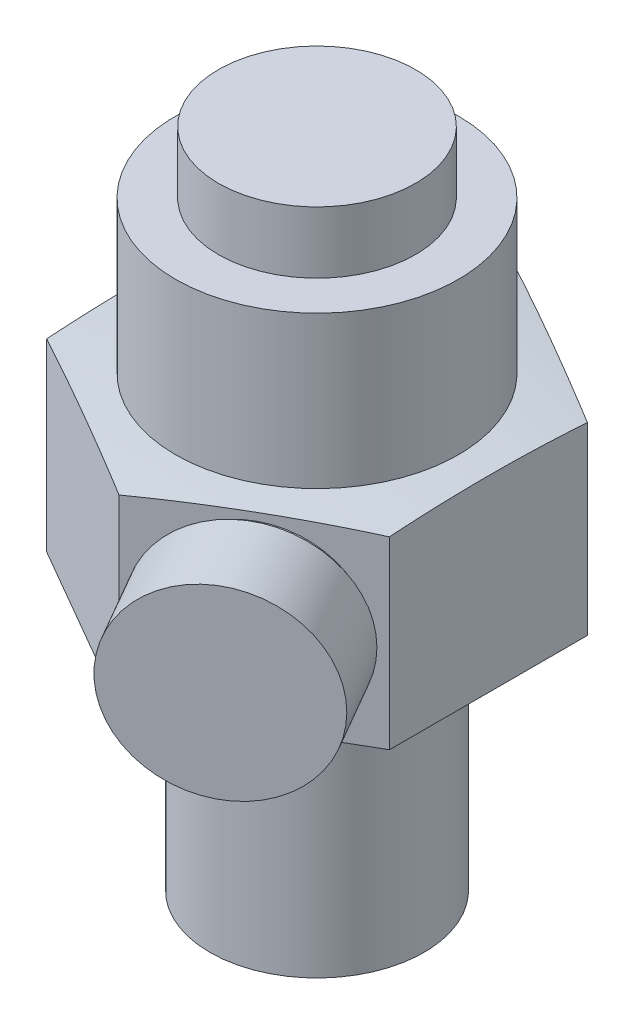
from build123d import *

# Parameters (mm, degrees)
SKETCH2_R                = 31.284897101
CUT_EXTRUDE2_DEPTH       = 58.150000089
SKETCH3_R                = 3.175
BOSS_EXTRUDE1_DEPTH      = 6.35
SKETCH4_R                = 6.35
BOSS_EXTRUDE3_DEPTH      = 6.35
BOSS_EXTRUDE4_DEPTH      = 0.508
BOSS_EXTRUDE4_DEPTH_BACK = 5.588
SKETCH5_R                = 6.858
SKETCH5_R_2              = 6.604
SKETCH5_3_R              = 6.604
BOSS_EXTRUDE5_DEPTH      = 0.508
SKETCH6_R                = 7.3025
BOSS_EXTRUDE6_DEPTH      = 4.572


with BuildPart() as part:
    # Sketch1 → Revolve1 (revolve)
    with BuildSketch(Plane(origin=(0, 0, 0), x_dir=(0, 0, -1), z_dir=(1, 0, 0))):
        with BuildLine():
            Line((10.4775, 33.195692203), (10.4775, 44.45))
            Line((10.4775, 44.45), (0, 44.45))
            Line((0, 44.45), (0, 0))
            Line((0, 0), (7.9375, 0))
            Line((7.9375, 0), (7.9375, 19.05))
            Line((7.9375, 19.05), (25.4, 19.05))
            Line((25.4, 19.05), (25.4, 30.511567858))
            ThreePointArc((25.4, 30.511567858), (17.996597132, 32.175233549), (10.4775, 33.195692203))
        make_face()
    revolve(axis=Axis((0, 0, 0), (0, 1, 0)))

    # Sketch2 → Cut-Extrude2 (cut, through all)
    with BuildSketch(Plane(origin=(0, 0, 0), x_dir=(1, 0, 0), z_dir=(0, 1, 0))):
        Circle(SKETCH2_R)
        Polygon((-12.7, 7.332348419), (0, 14.664696837), (12.7, 7.332348419), (12.7, -7.332348419), (0, -14.664696837), (-12.7, -7.332348419), align=None, mode=Mode.SUBTRACT)
    extrude(amount=CUT_EXTRUDE2_DEPTH, mode=Mode.SUBTRACT)

    # Sketch3 → Boss-Extrude1 (add)
    with BuildSketch(Plane(origin=(-6.35, 0, -10.998522628), x_dir=(-0.8660254037844386, 0, 0.5000000000000002), z_dir=(-0.5000000000000001, 0, -0.8660254037844385))):
        with Locations((0, 26.307433584)):
            Circle(SKETCH3_R)
    extrude(amount=BOSS_EXTRUDE1_DEPTH)

    # Sketch4 → Boss-Extrude3 (add)
    with BuildSketch(Plane(origin=(6.35, 0, 10.998522628), x_dir=(0.8660254037844406, 0, -0.49999999999999684), z_dir=(0.49999999999999684, 0, 0.8660254037844406))):
        with Locations((0, 26.044781418)):
            Circle(SKETCH4_R)
    extrude(amount=BOSS_EXTRUDE3_DEPTH)



with BuildPart() as body_2:
    # Sketch5 → Boss-Extrude4 (new, two sides: drawn at the far end of the back side and taken through both)
    with BuildSketch(Plane(origin=(9.525, 0, 16.497783942), x_dir=(0.8660254037844405, 0, -0.49999999999999695), z_dir=(0.4999999999999969, 0, 0.8660254037844404)).offset(-BOSS_EXTRUDE4_DEPTH_BACK)):
        with Locations((0, 26.044781418)):
            Circle(SKETCH5_R)
        with Locations((0, 26.044781418)):
            Circle(SKETCH5_R_2, mode=Mode.SUBTRACT)
    extrude(amount=BOSS_EXTRUDE4_DEPTH + BOSS_EXTRUDE4_DEPTH_BACK)


with BuildPart() as part_1:
    add(part.part)

    add(body_2.part)  # Boss-Extrude5 merges body 2
    # Sketch5<3> → Boss-Extrude5 (add)
    with BuildSketch(Plane(origin=(9.525, 0, 16.497783942), x_dir=(0.8660254037844405, 0, -0.49999999999999695), z_dir=(0.4999999999999969, 0, 0.8660254037844404))):
        with Locations((0, 26.044781418)):
            Circle(SKETCH5_3_R)
    extrude(amount=BOSS_EXTRUDE5_DEPTH)

    # Sketch6 → Boss-Extrude6 (add)
    with BuildSketch(Plane(origin=(0, 44.45, 0), x_dir=(1, 0, 0), z_dir=(0, 1, 0))):
        Circle(SKETCH6_R)
    extrude(amount=BOSS_EXTRUDE6_DEPTH)


solid = part_1.part
